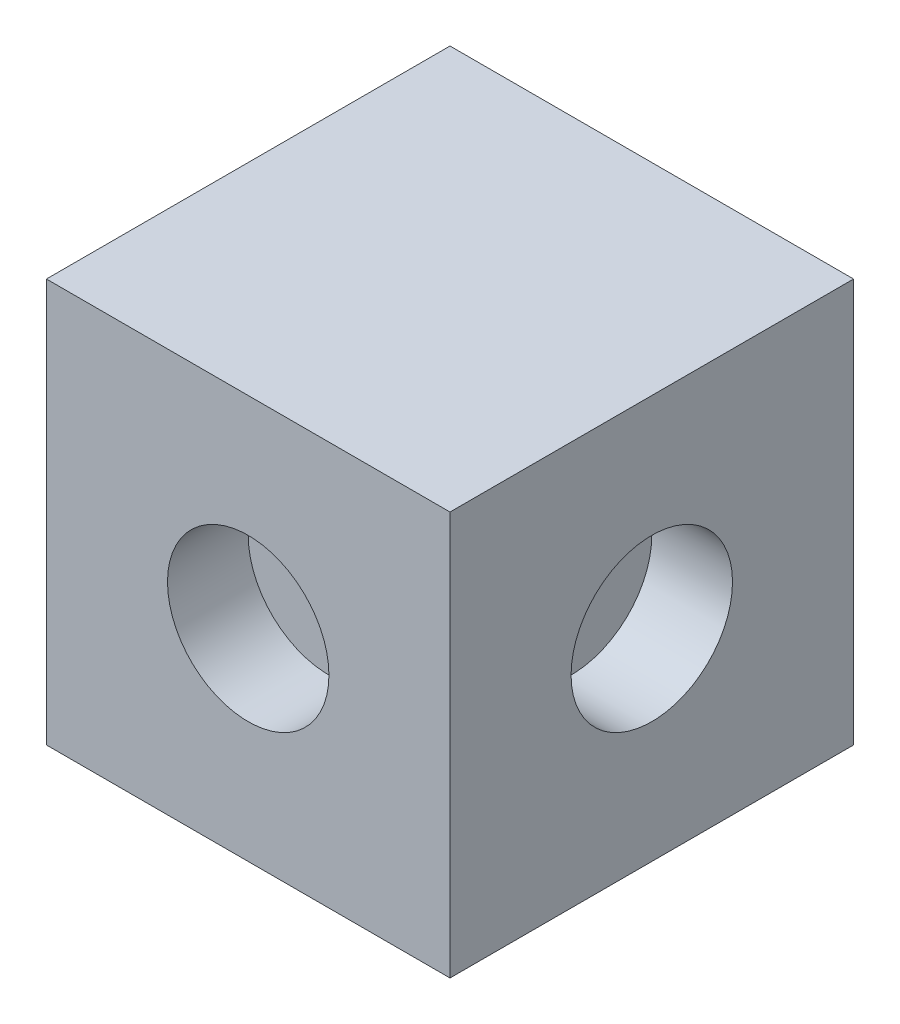
from build123d import *

# Parameters (mm, degrees)
CROQUIS1_W              = 50
CROQUIS1_H              = 50
SALIENTE_EXTRUIR1_DEPTH = 50
CROQUIS2_R              = 10
CORTAR_EXTRUIR1_DEPTH   = 10
CROQUIS3_R              = 10
CORTAR_EXTRUIR2_DEPTH   = 10
CORTAR_EXTRUIR3_START   = -10
CROQUIS4_R              = 10
CORTAR_EXTRUIR3_DEPTH   = 10
CORTAR_EXTRUIR4_START   = -10
CROQUIS5_R              = 10
CORTAR_EXTRUIR4_DEPTH   = 10


with BuildPart() as part:
    # Croquis1 → Saliente-Extruir1 (new body)
    with BuildSketch(Plane(origin=(0, 0, 0), x_dir=(1, 0, 0), z_dir=(0, 1, 0))):
        Rectangle(CROQUIS1_W, CROQUIS1_H)
    extrude(amount=SALIENTE_EXTRUIR1_DEPTH)

    # Croquis2 → Cortar-Extruir1 (cut)
    with BuildSketch(Plane.XY.offset(25)):
        with Locations((0, 25)):
            Circle(CROQUIS2_R)
    extrude(amount=-CORTAR_EXTRUIR1_DEPTH, mode=Mode.SUBTRACT)

    # Croquis3 → Cortar-Extruir2 (cut)
    with BuildSketch(Plane(origin=(25, 0, 0), x_dir=(0, 0, -1), z_dir=(1, 0, 0))):
        with Locations((0, 25)):
            Circle(CROQUIS3_R)
    extrude(amount=-CORTAR_EXTRUIR2_DEPTH, mode=Mode.SUBTRACT)

    # Croquis4 → Cortar-Extruir3 (cut)
    with BuildSketch(Plane(origin=(0, 0, -25), x_dir=(-1, 0, 0), z_dir=(0, 0, -1)).offset(CORTAR_EXTRUIR3_START)):
        with Locations(Location((0, 25, 0), (0, 0, 180))):
            Circle(CROQUIS4_R)
    extrude(amount=CORTAR_EXTRUIR3_DEPTH, mode=Mode.SUBTRACT)

    # Croquis5 → Cortar-Extruir4 (cut)
    with BuildSketch(Plane.ZY.offset(25).offset(CORTAR_EXTRUIR4_START)):
        with Locations(Location((0, 25, 0), (0, 0, 180))):
            Circle(CROQUIS5_R)
    extrude(amount=CORTAR_EXTRUIR4_DEPTH, mode=Mode.SUBTRACT)


solid = part.part
